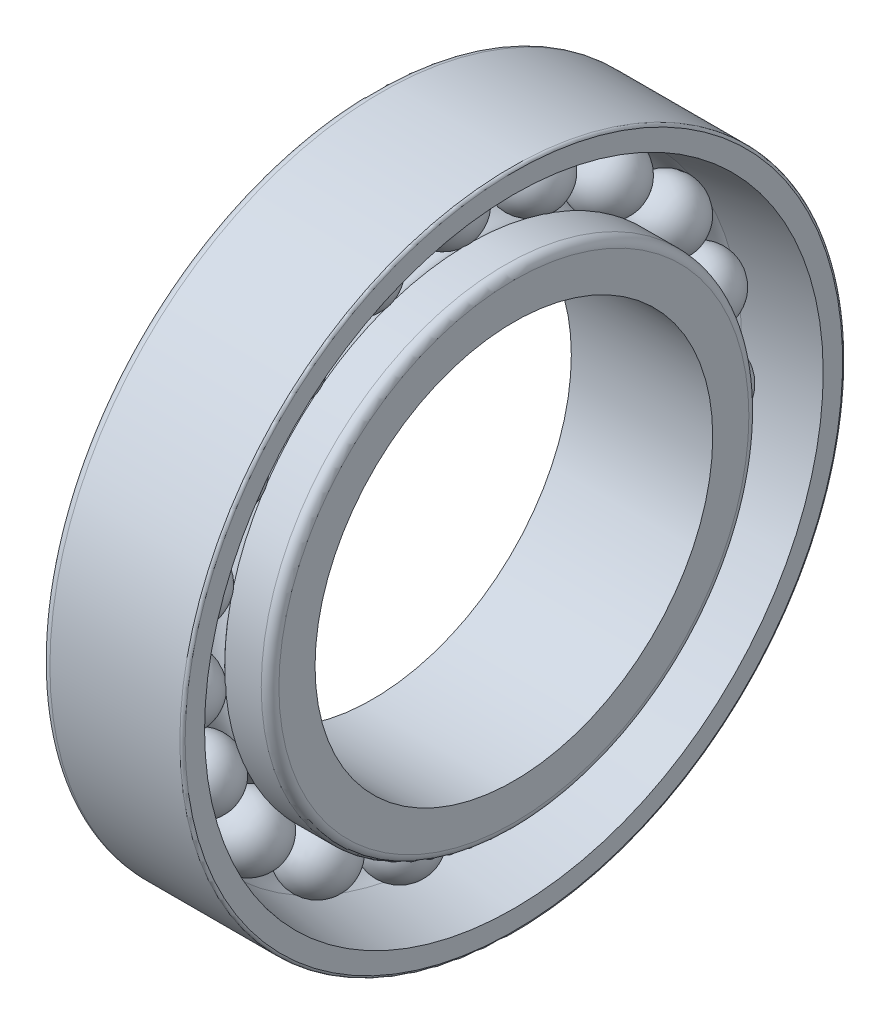
from build123d import *

# Parameters (mm, degrees)
FILLET_1_R               = 0.3
FILLET_2_R               = 1
PATTERN_CIRCULAR_2_COUNT = 19


with BuildPart() as part:
    # 草图2 → Revolve 975 (revolve)
    with BuildSketch(Plane.XY, mode=Mode.PRIVATE) as revolve_975_sk:
        with BuildLine():
            Line((0, 37.5), (16, 37.5))
            Line((16, 37.5), (16, 35))
            Line((16, 35), (8, 33.75))
            ThreePointArc((8, 33.75), (6.415181518, 33.398654201), (5.127333338, 32.410453536))
            Line((5.127333338, 32.410453536), (0, 32.410453536))
            Line((0, 32.410453536), (0, 37.5))
        make_face()
    revolve(revolve_975_sk.sketch.rotate(Axis((0, 0, 0), (1, 0, 0)), 90), axis=Axis((0, 0, 0), (1, 0, 0)))

    # 草图3 → 凸台-旋转1 (revolve)
    with BuildSketch(Plane.XY):
        with BuildLine():
            Line((11.8, 30), (4.2, 30))
            ThreePointArc((4.2, 30), (8, 33.8), (11.8, 30))
        make_face()
    revolve_1 = revolve(axis=Axis((0, 30, 0), (1, 0, 0)))

    # 草图4 → 凸台-旋转2 (revolve)
    with BuildSketch(Plane.XY, mode=Mode.PRIVATE) as revolve_2_sk:
        with BuildLine():
            Line((16, 22.5), (16, 27.589546464))
            Line((16, 27.589546464), (10.872666662, 27.589546464))
            ThreePointArc((10.872666662, 27.589546464), (8, 26.25), (5.127333338, 27.589546464))
            Line((5.127333338, 27.589546464), (0, 27.589546464))
            Line((0, 27.589546464), (0, 22.5))
            Line((0, 22.5), (16, 22.5))
        make_face()
    revolve(revolve_2_sk.sketch.rotate(Axis((0, 0, 0), (1, 0, 0)), 90), axis=Axis((0, 0, 0), (1, 0, 0)))

    # 圆角1
    fillet_1_edges = [part.edges().sort_by_distance(p)[0] for p in [
        (16, 0, -37.5),
    ]]
    fillet(fillet_1_edges, radius=FILLET_1_R)

    # 圆角2
    fillet_2_edges = [part.edges().sort_by_distance(p)[0] for p in [
        (16, 0, -27.589546464),
        (0, 0, -37.5),
    ]]
    fillet(fillet_2_edges, radius=FILLET_2_R)

    # 阵列(圆周)2: 凸台-旋转1 ×19 about axis
    pattern_circular_2_axis = Axis((0, 0, 0), (1, 0, 0))
    for i in range(1, PATTERN_CIRCULAR_2_COUNT):
        add(revolve_1.rotate(pattern_circular_2_axis, i * 360 / PATTERN_CIRCULAR_2_COUNT))


solid = part.part
